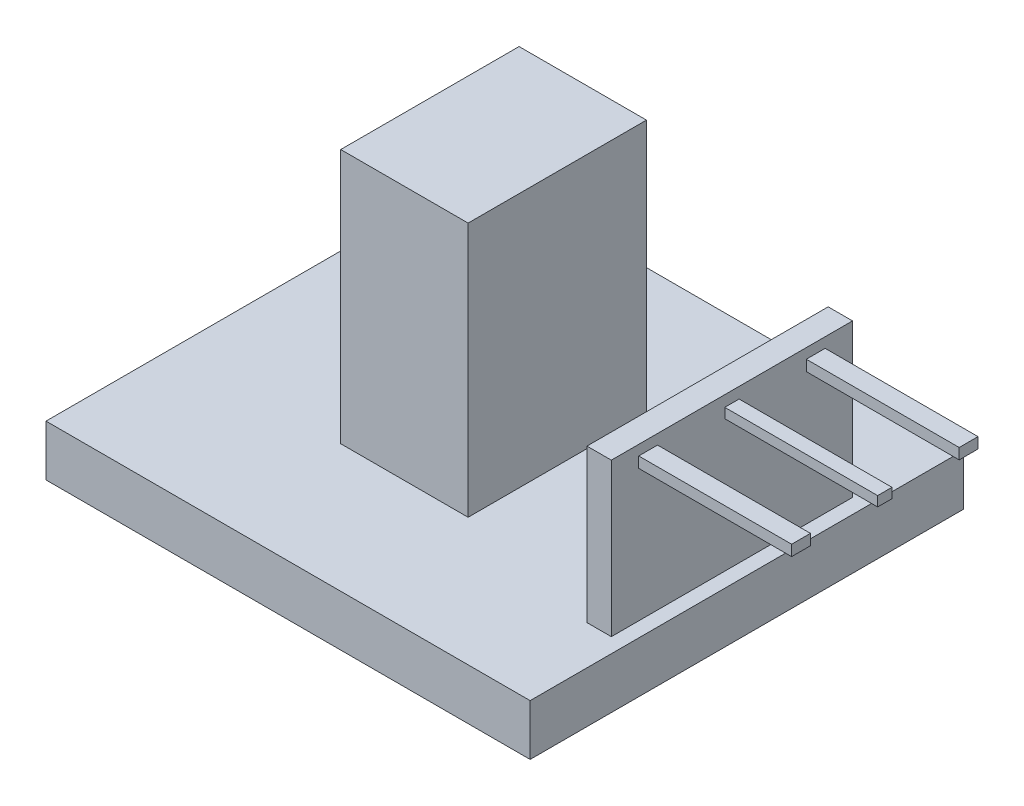
from build123d import *

# Parameters (mm, degrees)
ESQUISSE1_W        = 19
ESQUISSE1_H        = 17
BOSS_EXTRU_1_DEPTH = 2
ESQUISSE2_W        = 0.955718941
ESQUISSE2_H        = 9.466168562
BOSS_EXTRU_2_DEPTH = 6
ESQUISSE3_W        = 0.738510091
ESQUISSE3_H        = 0.422005766
BOSS_EXTRU_3_DEPTH = 6
ESQUISSE4_W        = 0.562674356
ESQUISSE4_H        = 0.386838619
BOSS_EXTRU_4_DEPTH = 6
ESQUISSE5_W        = 5
ESQUISSE5_H        = 7
BOSS_EXTRU_5_DEPTH = 10


with BuildPart() as part:
    # Esquisse1 → Boss.-Extru.1 (new body)
    with BuildSketch(Plane(origin=(0, 0, 0), x_dir=(1, 0, 0), z_dir=(0, 1, 0))):
        Rectangle(ESQUISSE1_W, ESQUISSE1_H)
    extrude(amount=BOSS_EXTRU_1_DEPTH)

    # Esquisse2 → Boss.-Extru.2 (add)
    with BuildSketch(Plane(origin=(0, 2, 0), x_dir=(1, 0, 0), z_dir=(0, 1, 0))):
        with Locations((8.442183982, 0)):
            Rectangle(ESQUISSE2_W, ESQUISSE2_H)
    extrude(amount=BOSS_EXTRU_2_DEPTH)

    # Esquisse3 → Boss.-Extru.3 (add)
    with BuildSketch(Plane(origin=(8.920043452, 0, 0), x_dir=(0, 0, -1), z_dir=(1, 0, 0))):
        with Locations((-3.288128263, 7.393629704)):
            Rectangle(ESQUISSE3_W, ESQUISSE3_H)
    boss_extru_3 = extrude(amount=BOSS_EXTRU_3_DEPTH)

    # Symétrie1: Boss.-Extru.3 across plane
    add(boss_extru_3.mirror(Plane.XY))

    # Esquisse4 → Boss.-Extru.4 (add)
    with BuildSketch(Plane(origin=(8.920043452, 0, 0), x_dir=(0, 0, -1), z_dir=(1, 0, 0))):
        with Locations((0, 7.376046131)):
            Rectangle(ESQUISSE4_W, ESQUISSE4_H)
    extrude(amount=BOSS_EXTRU_4_DEPTH)

    # Esquisse5 → Boss.-Extru.5 (add)
    with BuildSketch(Plane(origin=(0, 2, 0), x_dir=(1, 0, 0), z_dir=(0, 1, 0))):
        with Locations((-0.447844474, 0.014350287)):
            Rectangle(ESQUISSE5_W, ESQUISSE5_H)
    extrude(amount=BOSS_EXTRU_5_DEPTH)


solid = part.part
